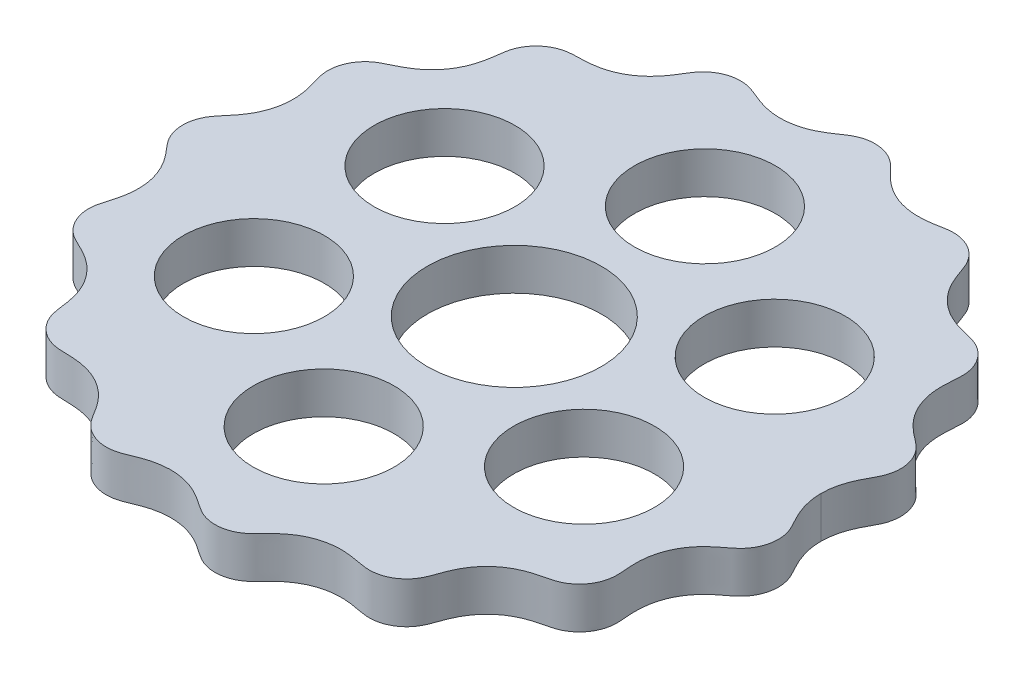
from build123d import *

# Parameters (mm, degrees)
SKETCH1_R           = 10.5
SKETCH1_R_2         = 8.5
BOSS_EXTRUDE1_DEPTH = 5


with BuildPart() as part:
    # Sketch1 → Boss-Extrude1 (new body)
    with BuildSketch(Plane(origin=(0, 0, 0), x_dir=(1, 0, 0), z_dir=(0, 1, 0))):
        with BuildLine():
            add(Edge.make_bspline(
                [(37, 0), (37, -0.03143727), (37.000453604, -0.094999987), (37.002494823, -0.209960319), (37.007935699, -0.365962041), (37.018130067, -0.547435978), (37.035778539, -0.762613663), (37.062295011, -1.000704503), (37.099596576, -1.254145629), (37.141666769, -1.490121949), (37.186730566, -1.707704996), (37.27599878, -2.086217996), (37.432607644, -2.61967024), (37.650272858, -3.191702622), (37.93344139, -3.795551093), (38.205952219, -4.315706499), (38.450459887, -4.76062227), (38.70692772, -5.235202277), (38.941768984, -5.756697541), (39.137855891, -6.378800099), (39.247955338, -7.103857197), (39.228570469, -7.939956238), (39.019285386, -8.855824089), (38.577559758, -9.823505319), (37.820964583, -10.754370622), (36.848063751, -11.434964366), (35.925475538, -12.170726431), (35.15516003, -12.931370117), (34.54379505, -13.69507461), (33.895237033, -14.741994379), (33.428420876, -15.89037885), (33.16127245, -17.104145416), (33.090755906, -18.276711654), (33.117928675, -19.134785899), (33.184630754, -19.922725011), (33.242632466, -20.644624385), (33.219628569, -21.437875666), (33.036316371, -22.28173929), (32.662226146, -23.128482681), (32.07870968, -23.926433825), (31.270520944, -24.647504284), (30.212930357, -25.19576041), (29.056187351, -25.42594367), (27.921165014, -25.714783041), (26.912865036, -26.088040867), (26.04670806, -26.526543792), (25.231490799, -27.070153578), (24.486296273, -27.71622491), (23.823206933, -28.456781999), (23.254813289, -29.28043732), (22.819009974, -30.105428972), (22.489240246, -30.904456359), (22.226168392, -31.656017359), (21.986325362, -32.344433223), (21.645702747, -33.067171886), (21.136896315, -33.772149992), (20.444596547, -34.405183963), (19.573466113, -34.908137767), (18.679093954, -35.191155105), (17.814153371, -35.279328837), (17.017950382, -35.212908103), (16.301803877, -35.076487108), (15.519474027, -34.928387551), (14.662477813, -34.814713427), (13.480415131, -34.769744424), (12.241149031, -34.919564924), (11.051981736, -35.275534422), (9.949378286, -35.820248955), (9.136432455, -36.351322247), (8.309098279, -37.037782148), (7.491403014, -37.876399023), (6.713712112, -38.763029071), (5.710099738, -39.404826424), (4.681547406, -39.744189192), (3.69873863, -39.8505626), (2.778395229, -39.751156366), (1.955929975, -39.487981912), (1.257453316, -39.111274686), (0.66127052, -38.700097998), (0.012246131, -38.248357139), (-0.717280827, -37.795796162), (-1.768012922, -37.270567489), (-2.952736789, -36.895066329), (-4.18067966, -36.725111536), (-5.411611299, -36.763370496), (-6.378691755, -36.910893685), (-7.422567545, -37.197831253), (-8.521082833, -37.628680279), (-9.596894828, -38.131330913), (-10.781414036, -38.320591213), (-11.865254321, -38.217684033), (-12.80999509, -37.9179101), (-13.765403055, -37.370059655), (-14.639711952, -36.510029042), (-15.224959632, -35.447056134), (-15.875186541, -34.432134449), (-16.722685045, -33.381987434), (-17.645169147, -32.549366784), (-18.695344862, -31.881164302), (-19.839308598, -31.40312617), (-20.793085274, -31.134677942), (-21.881721133, -30.964500419), (-23.08542905, -30.908652495), (-24.29883225, -30.933417715), (-25.48067958, -30.606197148), (-26.432898172, -30.052748185), (-27.164845045, -29.384446693), (-27.795906987, -28.497278622), (-28.22424747, -27.376816763), (-28.326856093, -26.193816745), (-28.502980453, -25.027046282), (-28.77642721, -23.979556749), (-29.132206305, -23.068277653), (-29.714540354, -21.983130932), (-30.47569585, -21.004677931), (-31.393252135, -20.166428114), (-32.373478982, -19.519081264), (-33.130172271, -19.113573458), (-33.84590289, -18.777371391), (-34.500084654, -18.46665169), (-35.175559662, -18.050104617), (-35.814710148, -17.469419426), (-36.360966848, -16.722076387), (-36.760254169, -15.817760446), (-36.980625548, -14.757313597), (-36.926633396, -13.567284637), (-36.547607451, -12.450425229), (-36.230236904, -11.323045642), (-36.049340213, -10.263206081), (-35.996011997, -9.293835892), (-36.059190915, -8.316040479), (-36.246094895, -7.347633334), (-36.555913141, -6.403126163), (-36.984986238, -5.49901541), (-37.4816085, -4.709168384), (-38.008605013, -4.023960492), (-38.528096971, -3.420524047), (-39.004092361, -2.868313105), (-39.352986229, -2.366627778), (-39.578197628, -1.930892754), (-39.717578718, -1.588781599), (-39.798314559, -1.352462416), (-39.865873622, -1.112280964), (-39.913167386, -0.899005121), (-39.945298995, -0.714032443), (-39.966442184, -0.560824819), (-39.979976403, -0.438104209), (-39.99012853, -0.310816751), (-39.99689741, -0.175935477), (-39.999435894, -0.081206791), (-40, -0.026915074), (-40, -1e-09)],
                knots=[0.06614426, 0.06614426, 0.06614426, 0.06614426, 0.06614426, 0.067102742, 0.068061224, 0.069019706, 0.069978188, 0.071895152, 0.073812116, 0.075273751, 0.076735387, 0.078197023, 0.079658659, 0.085505202, 0.091351745, 0.094275016, 0.097198288, 0.100954467, 0.104710646, 0.108466825, 0.112223004, 0.118069589, 0.123916173, 0.130338535, 0.136760898, 0.145879075, 0.154997253, 0.161421442, 0.167845631, 0.17426982, 0.18069401, 0.193736695, 0.200258038, 0.206779381, 0.211541823, 0.216304265, 0.221066707, 0.225829148, 0.232348859, 0.238868571, 0.245245472, 0.251622373, 0.260676895, 0.269731417, 0.276109562, 0.282487707, 0.288865852, 0.295243997, 0.301811097, 0.308378198, 0.314945298, 0.321512399, 0.326307116, 0.331101834, 0.335896552, 0.340691269, 0.347256117, 0.353820965, 0.360385813, 0.366950661, 0.371745379, 0.376540096, 0.381334814, 0.386129532, 0.392696632, 0.399263733, 0.412397934, 0.418776079, 0.425154223, 0.431532368, 0.437910513, 0.446965035, 0.456019557, 0.462396459, 0.46877336, 0.475293071, 0.481812782, 0.486575224, 0.491337666, 0.496100107, 0.500862549, 0.507383892, 0.513905235, 0.526947921, 0.53337211, 0.539796299, 0.546220489, 0.552644678, 0.561762855, 0.570881032, 0.577303395, 0.583725757, 0.590229974, 0.596734191, 0.606102622, 0.615471053, 0.621977695, 0.628484337, 0.641497621, 0.648004263, 0.654510905, 0.661017547, 0.667524189, 0.67689262, 0.686261051, 0.692765268, 0.699269485, 0.705691847, 0.71211421, 0.721232387, 0.730350565, 0.736774754, 0.743198943, 0.749623132, 0.756047322, 0.769090007, 0.77561135, 0.782132693, 0.786895135, 0.791657577, 0.796420019, 0.80118246, 0.807702171, 0.814221883, 0.820598784, 0.826975685, 0.836030207, 0.845084729, 0.851462874, 0.857841019, 0.864219164, 0.870597309, 0.877164409, 0.88373151, 0.89029861, 0.896865711, 0.901660428, 0.906455146, 0.911249864, 0.916044581, 0.917685793, 0.919327005, 0.920968217, 0.922609429, 0.924250641, 0.925071247, 0.925891853, 0.926712459, 0.927533065, 0.928353671, 0.929174277, 0.929174277, 0.929174277, 0.929174277, 0.929174277], degree=4))
            add(Edge.make_bspline(
                [(-40, -1e-09), (-40, 0.026915073), (-39.999435898, 0.081102132), (-39.996897439, 0.173969707), (-39.990128591, 0.308512197), (-39.979976315, 0.43784111), (-39.96644193, 0.561596862), (-39.949527385, 0.683811751), (-39.92923545, 0.806418669), (-39.905569953, 0.929082564), (-39.878536112, 1.05108509), (-39.840542165, 1.202393225), (-39.788245672, 1.382030281), (-39.717511124, 1.588706673), (-39.612678592, 1.8465975), (-39.4787487, 2.123083835), (-39.310663945, 2.414096923), (-39.104945299, 2.715281305), (-38.881313352, 3.003243592), (-38.647115103, 3.282501031), (-38.34984736, 3.627713203), (-37.95291863, 4.096180366), (-37.481683121, 4.709256859), (-36.984926096, 5.498908372), (-36.555971315, 6.403267497), (-36.170215472, 7.578337946), (-35.9868127, 8.798814705), (-36.009059108, 10.024440425), (-36.200622014, 11.152023378), (-36.408520549, 11.955019807), (-36.630718407, 12.680349542), (-36.821563566, 13.341696839), (-36.992348492, 14.33180594), (-36.904909082, 15.422182159), (-36.504382838, 16.524262833), (-35.814997617, 17.469697467), (-35.175412137, 18.050006312), (-34.5001255, 18.466591368), (-33.84600501, 18.777687977), (-32.905560624, 19.218134843), (-31.725163504, 19.887218348), (-30.439584969, 20.966645125), (-29.285197967, 22.586057403), (-28.686625036, 24.137217697), (-28.434119871, 25.439027518), (-28.31164158, 26.439459997), (-28.21864172, 27.126579635), (-28.036118522, 27.870890122), (-27.694662989, 28.638492196), (-27.164686183, 29.384972568), (-26.433444718, 30.052566346), (-25.634630631, 30.516068805), (-24.823088132, 30.788827784), (-24.04685872, 30.899230803), (-23.334712945, 30.920266621), (-22.306444557, 30.937751057), (-20.963494482, 31.058617768), (-19.344902311, 31.506985138), (-17.613398371, 32.506669405), (-16.415804752, 33.684227657), (-15.639656073, 34.786823183), (-15.110379913, 35.668587511), (-14.736089473, 36.274805934), (-14.252362947, 36.891838815), (-13.610375494, 37.458275746), (-12.809563546, 37.918317809), (-11.865789642, 38.217794604), (-10.954330273, 38.303527797), (-10.118839611, 38.215435923), (-9.382986221, 38.00135041), (-8.741423229, 37.738330824), (-7.813784142, 37.344183911), (-6.560131184, 36.91195486), (-4.917500499, 36.654754125), (-2.937854825, 36.844776382), (-1.360254549, 37.418406773), (-0.190612674, 38.106118753), (0.66104769, 38.700344294), (1.25752551, 39.11128049), (1.955942055, 39.487804143), (2.778297019, 39.751545742), (3.94176, 39.875855803), (5.096453052, 39.671677477), (6.084466159, 39.202219931), (6.856533473, 38.559253291), (7.333854157, 38.063319478), (7.850909823, 37.508190885), (8.442374814, 36.92670684), (9.323110596, 36.196912537), (10.58841665, 35.435636692), (11.999200644, 34.94870835), (13.48033229, 34.769799778), (14.662523081, 34.814686453), (15.519442707, 34.928402455), (16.301826743, 35.076481327), (17.01792965, 35.21290787), (17.814178726, 35.27933238), (18.679056308, 35.191146999), (19.573524947, 34.908152618), (20.444504658, 34.405159426), (21.137044029, 33.772190195), (21.591803381, 33.141505578), (21.869639533, 32.592625152), (22.075891139, 32.086193752), (22.226561366, 31.656080042), (22.376591176, 31.226097871), (22.593668003, 30.651444897), (22.86151291, 30.024879345), (23.255100485, 29.280174836), (23.822818619, 28.457094584), (24.649069231, 27.534594711), (25.802527601, 26.61516732), (27.218058872, 25.905303721), (28.817567995, 25.472660001), (30.452832349, 25.14875342), (31.698805724, 24.383263182), (32.56091801, 23.351770837), (33.037621539, 22.281751264), (33.218869869, 21.437861265), (33.242984107, 20.64464847), (33.184772246, 19.922675951), (33.096291135, 18.887971334), (33.085336205, 17.531197285), (33.377495648, 15.878125019), (34.202660288, 14.068701252), (35.246780487, 12.774733869), (36.247889348, 11.905159004), (37.053074749, 11.298868113), (37.601617193, 10.874775338), (38.154972669, 10.344538529), (38.64897071, 9.665047684), (39.030511654, 8.832802317), (39.242952499, 7.865782472), (39.245093638, 6.94215806), (39.075312522, 6.10308858), (38.783182879, 5.375443563), (38.444617083, 4.748588598), (38.126578469, 4.173031944), (37.854861766, 3.633998474), (37.633034591, 3.131674523), (37.47857496, 2.727184292), (37.362612428, 2.374730281), (37.2774171, 2.077549654), (37.216377239, 1.837879163), (37.162604445, 1.596443845), (37.116253691, 1.353582746), (37.077446812, 1.109379842), (37.050179424, 0.893728529), (37.031634183, 0.710857807), (37.019415923, 0.558351339), (37.011589025, 0.433066649), (37.00424606, 0.269586224), (37.00097986, 0.133534053), (37, 0.053352873), (37, 0)],
                knots=[0.070825729, 0.070825729, 0.070825729, 0.070825729, 0.070825729, 0.071646335, 0.072466941, 0.073287547, 0.074108153, 0.074928759, 0.075749365, 0.076569971, 0.077390577, 0.078211183, 0.079031789, 0.080673002, 0.082314214, 0.083955426, 0.086352785, 0.088750144, 0.091147503, 0.093544862, 0.095942221, 0.09833958, 0.103134298, 0.109701399, 0.1162685, 0.122835601, 0.129402703, 0.142158993, 0.148537139, 0.154915284, 0.159442546, 0.163969807, 0.168497068, 0.17302433, 0.185778133, 0.192297845, 0.198817557, 0.203579999, 0.208342441, 0.213104883, 0.217867326, 0.230910013, 0.243952699, 0.256801079, 0.269649459, 0.274208548, 0.278767637, 0.283326726, 0.287885815, 0.294308178, 0.300730541, 0.307234758, 0.313738976, 0.318423192, 0.323107408, 0.327791624, 0.33247584, 0.345489125, 0.35850241, 0.371515695, 0.38452898, 0.389213196, 0.393897412, 0.398581628, 0.403265844, 0.409770061, 0.416274278, 0.422696641, 0.429119005, 0.433678094, 0.438237183, 0.442796272, 0.447355361, 0.46020374, 0.47305212, 0.486094807, 0.499137494, 0.503899936, 0.508662378, 0.51342482, 0.518187263, 0.524706974, 0.531226686, 0.54398049, 0.548507751, 0.553035012, 0.557562274, 0.562089535, 0.568467681, 0.574845826, 0.587602117, 0.600736319, 0.60730342, 0.613870521, 0.618665239, 0.623459957, 0.628254676, 0.633049394, 0.639614242, 0.64617909, 0.652743939, 0.659308787, 0.664103505, 0.666500865, 0.668898224, 0.673692942, 0.676090301, 0.67848766, 0.685054761, 0.691621862, 0.698188963, 0.704756064, 0.717512355, 0.730268646, 0.739323169, 0.748377691, 0.761131495, 0.767651207, 0.774170918, 0.778933361, 0.783695803, 0.788458245, 0.793220687, 0.806263374, 0.819306061, 0.832154441, 0.84500282, 0.849561909, 0.854120998, 0.858680087, 0.863239176, 0.869661539, 0.876083903, 0.88258812, 0.889092337, 0.893776553, 0.898460769, 0.903144985, 0.907829201, 0.911082522, 0.914335844, 0.917589165, 0.919215826, 0.920842486, 0.922469147, 0.924095807, 0.925722468, 0.927349129, 0.928975789, 0.92978912, 0.93060245, 0.93141578, 0.932229111, 0.933855771, 0.933855771, 0.933855771, 0.933855771, 0.933855771], degree=4))
        make_face()
        with Locations(Location((0, 0, 0), (0, 0, 270))):
            Circle(SKETCH1_R, mode=Mode.SUBTRACT)
        with Locations(Location((0, 23, 0), (0, 0, 270))):
            Circle(SKETCH1_R_2, mode=Mode.SUBTRACT)
        with Locations(Location((19.918584287, 11.5, 0), (0, 0, 270))):
            Circle(SKETCH1_R_2, mode=Mode.SUBTRACT)
        with Locations(Location((19.918584287, -11.5, 0), (0, 0, 270))):
            Circle(SKETCH1_R_2, mode=Mode.SUBTRACT)
        with Locations(Location((0, -23, 0), (0, 0, 270))):
            Circle(SKETCH1_R_2, mode=Mode.SUBTRACT)
        with Locations(Location((-19.918584287, -11.5, 0), (0, 0, 270))):
            Circle(SKETCH1_R_2, mode=Mode.SUBTRACT)
        with Locations(Location((-19.918584287, 11.5, 0), (0, 0, 270))):
            Circle(SKETCH1_R_2, mode=Mode.SUBTRACT)
    extrude(amount=BOSS_EXTRUDE1_DEPTH)


solid = part.part
